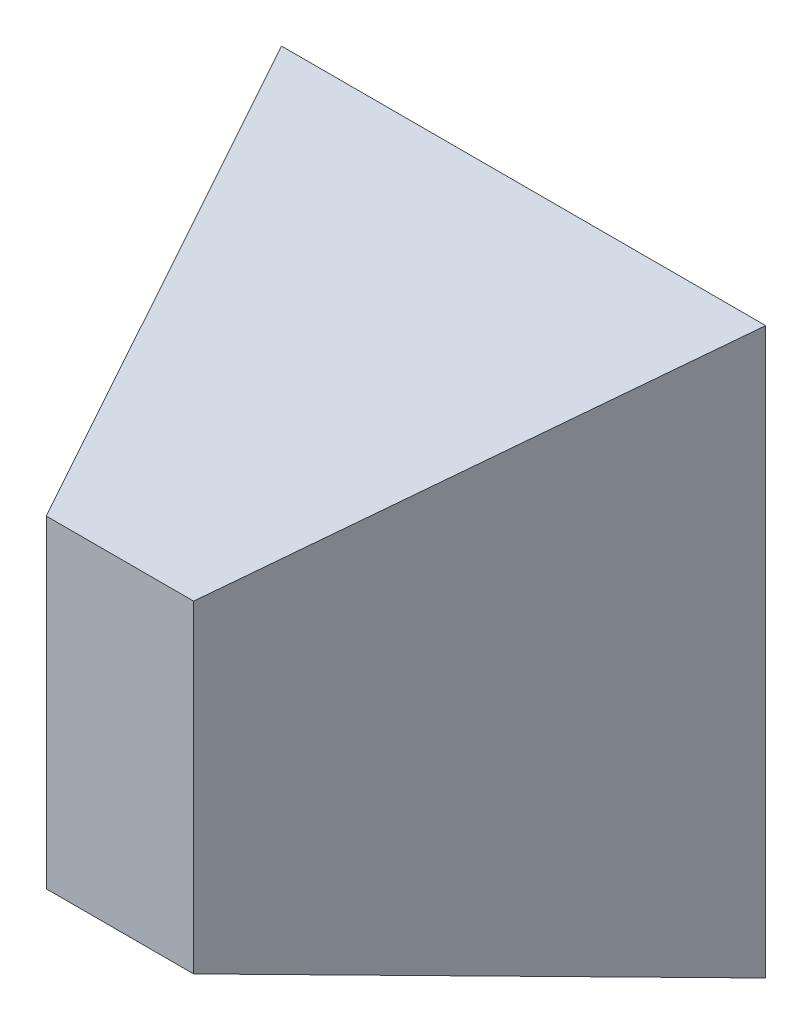
from build123d import *


with BuildPart() as part:
    # Sketch2 → Loft1 section 0
    with BuildSketch(Plane.XY.offset(254)):
        with BuildLine():
            Line((-46.355, -101.6), (46.355, -101.6))
            Line((46.355, -101.6), (46.355, 101.6))
            Line((46.355, 101.6), (-46.355, 101.6))
            Line((-46.355, 101.6), (-46.355, -101.6))
        make_face()
    # Sketch1 → Loft1 section 1
    with BuildSketch(Plane.XY):
        with BuildLine():
            Line((-152.4, -177.8), (152.4, -177.8))
            Line((152.4, -177.8), (152.4, 177.8))
            Line((152.4, 177.8), (-152.4, 177.8))
            Line((-152.4, 177.8), (-152.4, -177.8))
        make_face()
    loft()


solid = part.part
